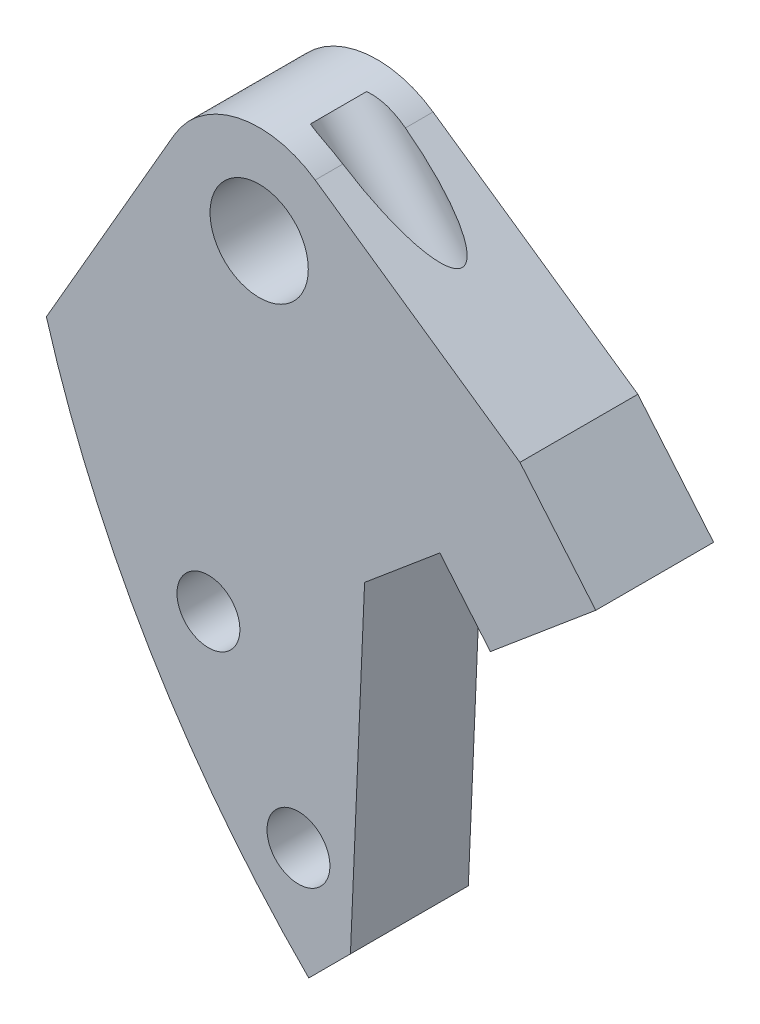
from build123d import *

# Parameters (mm, degrees)
SKETCH_2_R          = 2.5
EXTRUDE_1_DEPTH     = 6
SKETCH_3_R          = 1.6
CUT_EXTRUDE_1_DEPTH = 10
SKETCH_4_R          = 1.6
CUT_EXTRUDE_2_DEPTH = 20


with BuildPart() as part:
    # 草图2 → 凸台-拉伸1 (new body)
    with BuildSketch(Plane.XY):
        with BuildLine():
            Line((-37.476659403, -37.476659403), (-35.355339059, -35.355339059))
            Line((-35.355339059, -35.355339059), (-34.635011938, -18.618967428))
            Line((-34.635011938, -18.618967428), (-30.804789722, -15.40502938))
            Line((-30.804789722, -15.40502938), (-28.233639283, -18.469207152))
            Line((-28.233639283, -18.469207152), (-22.871328181, -13.969693884))
            Line((-22.871328181, -13.969693884), (-25.44247862, -10.905516112))
            Line((-25.44247862, -10.905516112), (-26.72805384, -9.373427226))
            Line((-26.72805384, -9.373427226), (-37.149566653, -2.1420772))
            ThreePointArc((-37.149566653, -2.1420772), (-41.092578269, -1.370832784), (-44.330127019, -3.75))
            Line((-44.330127019, -3.75), (-50.830440783, -15.008873704))
            ThreePointArc((-50.830440783, -15.008873704), (-45.560249498, -27.07884166), (-37.476659403, -37.476659403))
        make_face()
        with Locations((-40, -6.25)):
            Circle(SKETCH_2_R, mode=Mode.SUBTRACT)
    extrude(amount=EXTRUDE_1_DEPTH)

    # 草图3 → 切除-拉伸1 (cut)
    with BuildSketch(Plane(origin=(0, 0, 0), x_dir=(-1, 0, 0), z_dir=(0, 0, -1))):
        with Locations((42.582783582, -23.873668727)):
            Circle(SKETCH_3_R)
        with Locations((38, -32)):
            Circle(SKETCH_3_R)
    extrude(amount=-CUT_EXTRUDE_1_DEPTH, mode=Mode.SUBTRACT)

    # 草图4 → 切除-拉伸2 (cut)
    with BuildSketch(Plane(origin=(-2.571150439, 3.064177772, 0), x_dir=(0.7660444431189767, 0.642787609686541, 0), z_dir=(0.642787609686541, -0.7660444431189767, 0))):
        with Locations((-30, 3)):
            Circle(SKETCH_4_R)
    extrude(amount=-CUT_EXTRUDE_2_DEPTH, mode=Mode.SUBTRACT)


solid = part.part
